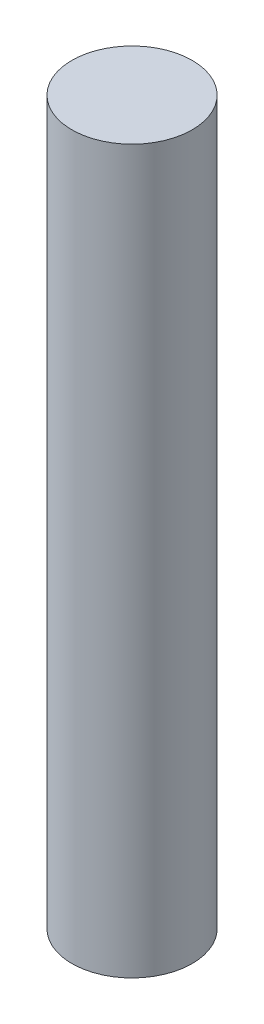
from build123d import *

# Parameters (mm, degrees)
SKETCH1_R           = 6.35
BOSS_EXTRUDE1_DEPTH = 38.1


with BuildPart() as part:
    # Sketch1 → Boss-Extrude1 (new, symmetric)
    with BuildSketch(Plane(origin=(0, 0, 0), x_dir=(1, 0, 0), z_dir=(0, 1, 0))):
        with Locations(Location((0, 0, 0), (0, 0, 90))):
            Circle(SKETCH1_R)
    extrude(amount=BOSS_EXTRUDE1_DEPTH, both=True)


solid = part.part
